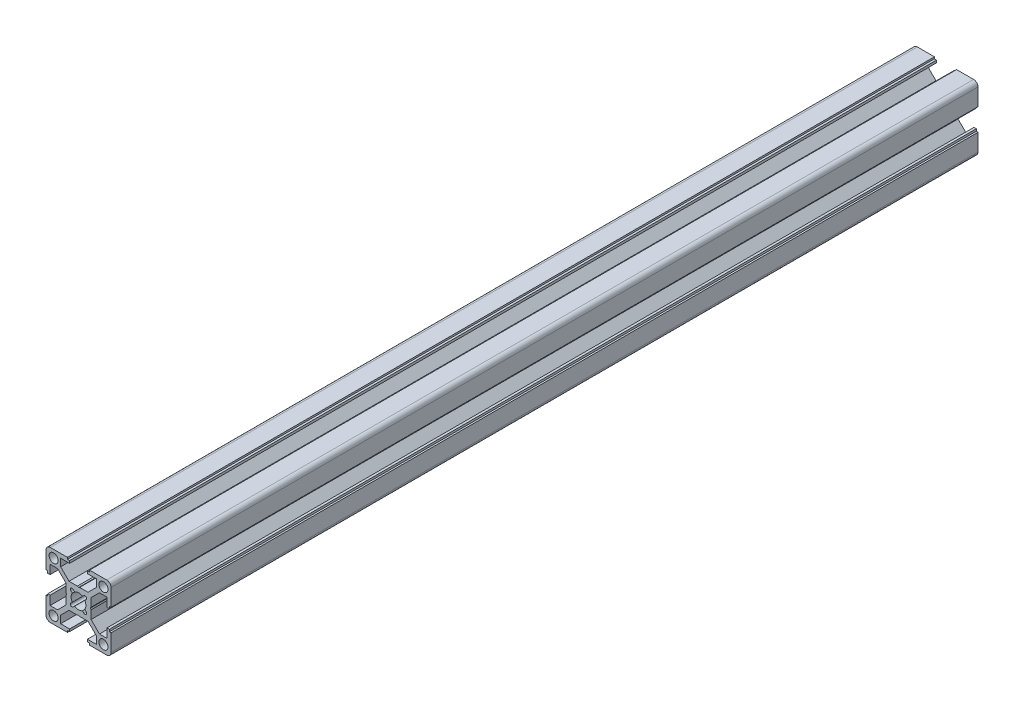
from build123d import *

# Parameters (mm, degrees)
SKETCH_28_R     = 2.1
EXTRUDE_1_DEPTH = 400


with BuildPart() as part:
    # 草图28 → 凸台-拉伸1 (new body)
    with BuildSketch(Plane.XY):
        with BuildLine():
            Line((-5.5, 0), (-5.8, -0.519615242))
            Line((-5.8, -0.519615242), (-5.8, -4.385786438))
            Line((-5.8, -4.385786438), (-9.664213562, -8.25))
            Line((-9.664213562, -8.25), (-13.1, -8.25))
            Line((-13.1, -8.25), (-13.1, -4.1))
            Line((-13.1, -4.1), (-14.2, -4.1))
            Line((-14.2, -4.1), (-14.2, -5.1))
            Line((-14.2, -5.1), (-15, -5.1))
            Line((-15, -5.1), (-15, -13))
            ThreePointArc((-15, -13), (-14.414213562, -14.414213562), (-13, -15))
            Line((-13, -15), (-5.1, -15))
            Line((-5.1, -15), (-5.1, -14.2))
            Line((-5.1, -14.2), (-4.1, -14.2))
            Line((-4.1, -14.2), (-4.1, -13.1))
            Line((-4.1, -13.1), (-8.25, -13.1))
            Line((-8.25, -13.1), (-8.25, -9.664213562))
            Line((-8.25, -9.664213562), (-4.385786438, -5.8))
            Line((-4.385786438, -5.8), (-0.519615242, -5.8))
            Line((-0.519615242, -5.8), (0, -5.5))
            Line((0, -5.5), (0.519615242, -5.8))
            Line((0.519615242, -5.8), (4.385786438, -5.8))
            Line((4.385786438, -5.8), (8.25, -9.664213562))
            Line((8.25, -9.664213562), (8.25, -13.1))
            Line((8.25, -13.1), (4.1, -13.1))
            Line((4.1, -13.1), (4.1, -14.2))
            Line((4.1, -14.2), (5.1, -14.2))
            Line((5.1, -14.2), (5.1, -15))
            Line((5.1, -15), (13, -15))
            ThreePointArc((13, -15), (14.414213562, -14.414213562), (15, -13))
            Line((15, -13), (15, -5.1))
            Line((15, -5.1), (14.2, -5.1))
            Line((14.2, -5.1), (14.2, -4.1))
            Line((14.2, -4.1), (13.1, -4.1))
            Line((13.1, -4.1), (13.1, -8.25))
            Line((13.1, -8.25), (9.664213562, -8.25))
            Line((9.664213562, -8.25), (5.8, -4.385786438))
            Line((5.8, -4.385786438), (5.8, -0.519615242))
            Line((5.8, -0.519615242), (5.5, 0))
            Line((5.5, 0), (5.8, 0.519615242))
            Line((5.8, 0.519615242), (5.8, 4.385786438))
            Line((5.8, 4.385786438), (9.664213562, 8.25))
            Line((9.664213562, 8.25), (13.1, 8.25))
            Line((13.1, 8.25), (13.1, 4.1))
            Line((13.1, 4.1), (14.2, 4.1))
            Line((14.2, 4.1), (14.2, 5.1))
            Line((14.2, 5.1), (15, 5.1))
            Line((15, 5.1), (15, 13))
            ThreePointArc((15, 13), (14.414213562, 14.414213562), (13, 15))
            Line((13, 15), (5.1, 15))
            Line((5.1, 15), (5.1, 14.2))
            Line((5.1, 14.2), (4.1, 14.2))
            Line((4.1, 14.2), (4.1, 13.1))
            Line((4.1, 13.1), (8.25, 13.1))
            Line((8.25, 13.1), (8.25, 9.664213562))
            Line((8.25, 9.664213562), (4.385786438, 5.8))
            Line((4.385786438, 5.8), (0.519615242, 5.8))
            Line((0.519615242, 5.8), (0, 5.5))
            Line((0, 5.5), (-0.519615242, 5.8))
            Line((-0.519615242, 5.8), (-4.385786438, 5.8))
            Line((-4.385786438, 5.8), (-8.25, 9.664213562))
            Line((-8.25, 9.664213562), (-8.25, 13.1))
            Line((-8.25, 13.1), (-4.1, 13.1))
            Line((-4.1, 13.1), (-4.1, 14.2))
            Line((-4.1, 14.2), (-5.1, 14.2))
            Line((-5.1, 14.2), (-5.1, 15))
            Line((-5.1, 15), (-13, 15))
            ThreePointArc((-13, 15), (-14.414213562, 14.414213562), (-15, 13))
            Line((-15, 13), (-15, 5.1))
            Line((-15, 5.1), (-14.2, 5.1))
            Line((-14.2, 5.1), (-14.2, 4.1))
            Line((-14.2, 4.1), (-13.1, 4.1))
            Line((-13.1, 4.1), (-13.1, 8.25))
            Line((-13.1, 8.25), (-9.664213562, 8.25))
            Line((-9.664213562, 8.25), (-5.8, 4.385786438))
            Line((-5.8, 4.385786438), (-5.8, 0.519615242))
            Line((-5.8, 0.519615242), (-5.5, 0))
        make_face()
        with Locations((11.5, -11.5)):
            Circle(SKETCH_28_R, mode=Mode.SUBTRACT)
        with Locations((-11.5, -11.5)):
            Circle(SKETCH_28_R, mode=Mode.SUBTRACT)
        with Locations((11.5, 11.5)):
            Circle(SKETCH_28_R, mode=Mode.SUBTRACT)
        with Locations((-11.5, 11.5)):
            Circle(SKETCH_28_R, mode=Mode.SUBTRACT)
        with BuildLine():
            Line((2.474873733, -3.535533907), (1.814611277, -2.875271451))
            ThreePointArc((1.814611277, -2.875271451), (0, -3.400000001), (-1.814611277, -2.875271452))
            Line((-1.814611277, -2.875271452), (-2.47487373, -3.535533905))
            ThreePointArc((-2.47487373, -3.535533905), (-3.535533904, -3.535533907), (-3.535533905, -2.474873733))
            Line((-3.535533905, -2.474873733), (-2.875271451, -1.814611279))
            ThreePointArc((-2.875271451, -1.814611279), (-3.400000001, 0), (-2.87527145, 1.814611278))
            Line((-2.87527145, 1.814611278), (-3.535533908, 2.474873736))
            ThreePointArc((-3.535533908, 2.474873736), (-3.535533907, 3.535533907), (-2.474873737, 3.535533906))
            Line((-2.474873737, 3.535533906), (-1.814611279, 2.875271449))
            ThreePointArc((-1.814611279, 2.875271449), (-1e-09, 3.399999999), (1.814611277, 2.875271449))
            Line((1.814611277, 2.875271449), (2.474873733, 3.535533905))
            ThreePointArc((2.474873733, 3.535533905), (3.535533905, 3.535533905), (3.535533905, 2.474873733))
            Line((3.535533905, 2.474873733), (2.875271449, 1.814611277))
            ThreePointArc((2.875271449, 1.814611277), (3.399999999, -1e-09), (2.875271449, -1.814611279))
            Line((2.875271449, -1.814611279), (3.535533905, -2.474873735))
            ThreePointArc((3.535533905, -2.474873735), (3.535533905, -3.535533907), (2.474873733, -3.535533907))
        make_face(mode=Mode.SUBTRACT)
    extrude(amount=EXTRUDE_1_DEPTH)


solid = part.part
